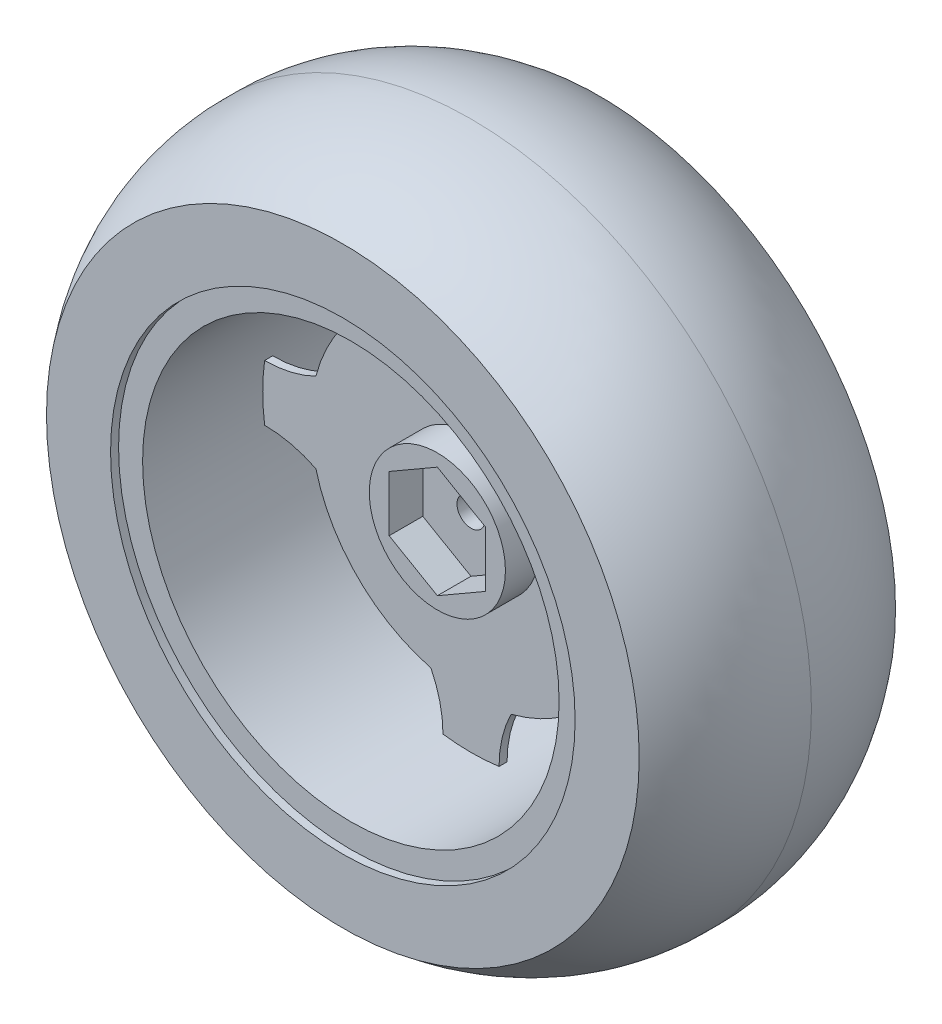
from build123d import *
from build123d.topology import SkipClean

# Parameters (mm, degrees)
SKETCH2_R            = 20
BOSS_EXTRUDE1_DEPTH  = 1
SKETCH3_R            = 8.5
BOSS_EXTRUDE2_DEPTH  = 4.2
BOSS_EXTRUDE4_DEPTH  = 2.5
BOSS_EXTRUDE5_DEPTH  = 3.5
CUT_EXTRUDE1_DEPTH   = 2.5
SKETCH14_R           = 1.75
CUT_EXTRUDE2_DEPTH   = 20.5
BOSS_EXTRUDE7_DEPTH  = 2.56
BOSS_EXTRUDE8_DEPTH  = 2.56
CUT_EXTRUDE4_DEPTH   = 1
CIRPATTERN3_COUNT    = 4
BOSS_EXTRUDE10_DEPTH = 2.56
SKETCH22_R           = 29
SKETCH22_R_2         = 26
BOSS_EXTRUDE11_DEPTH = 15
BOSS_EXTRUDE12_START = 15
SKETCH23_R           = 29
SKETCH23_R_2         = 26
BOSS_EXTRUDE12_DEPTH = 15
SKETCH25_R           = 37
SKETCH25_R_2         = 29
BOSS_EXTRUDE14_DEPTH = 16
BOSS_EXTRUDE15_START = 16
SKETCH26_R           = 37
SKETCH26_R_2         = 29
BOSS_EXTRUDE15_DEPTH = 16
SKETCH27_W           = 4.936524623
SKETCH27_H           = 8
BOSS_EXTRUDE16_DEPTH = 16
SKETCH29_W           = 16
SKETCH29_H           = 8
CUT_EXTRUDE5_DEPTH   = 16


with BuildPart() as part:
    # Sketch2 → Boss-Extrude1 (new body)
    with BuildSketch(Plane.XY):
        Circle(SKETCH2_R)
    extrude(amount=BOSS_EXTRUDE1_DEPTH)

    # Sketch3 → Boss-Extrude2 (add)
    with BuildSketch(Plane.XY.offset(1)):
        Circle(SKETCH3_R)
        Polygon((0, 6.95), (-6.018876556, 3.475), (-6.018876556, -3.475), (0, -6.95), (6.018876556, -3.475), (6.018876556, 3.475), align=None, mode=Mode.SUBTRACT)
    extrude(amount=BOSS_EXTRUDE2_DEPTH)

    # Sketch7 → Boss-Extrude4 (add)
    with BuildSketch(Plane(origin=(0, 0, 0), x_dir=(-1, 0, 0), z_dir=(0, 0, -1))):
        with BuildLine():
            Line((-12.53, 0), (0, 0))
            Line((0, 0), (12.53, 0))
            ThreePointArc((12.53, 0), (0, 12.53), (-12.53, 0))
        make_face()
    extrude(amount=BOSS_EXTRUDE4_DEPTH)

    # Sketch10 → Revolve1 (revolve)
    with BuildSketch(Plane.XZ):
        Polygon((12.53, -2.5), (20, 0), (12.53, 0), (0, 0), (0, -2.5), align=None)
    revolve(axis=Axis((0, 0, 0), (0, 0, -1)))

    # Sketch11 → Boss-Extrude5 (add)
    with BuildSketch(Plane(origin=(0, 0, -2.5), x_dir=(-1, 0, 0), z_dir=(0, 0, -1))):
        with BuildLine():
            ThreePointArc((25.763346056, -3.5), (22.477394983, -3.88001547), (19.364916731, -5))
            ThreePointArc((19.364916731, -5), (20, 0), (19.364916731, 5))
            ThreePointArc((19.364916731, 5), (22.477394983, 3.88001547), (25.763346056, 3.5))
            ThreePointArc((25.763346056, 3.5), (26, 0), (25.763346056, -3.5))
        make_face()
        with BuildLine():
            ThreePointArc((3.5, 25.763346056), (3.88001547, 22.477394983), (5, 19.364916731))
            ThreePointArc((5, 19.364916731), (0, 20), (-5, 19.364916731))
            ThreePointArc((-5, 19.364916731), (-3.88001547, 22.477394983), (-3.5, 25.763346056))
            ThreePointArc((-3.5, 25.763346056), (0, 26), (3.5, 25.763346056))
        make_face()
        with BuildLine():
            ThreePointArc((-3.5, -25.763346056), (-3.88001547, -22.477394983), (-5, -19.364916731))
            ThreePointArc((-5, -19.364916731), (0, -20), (5, -19.364916731))
            ThreePointArc((5, -19.364916731), (3.88001547, -22.477394983), (3.5, -25.763346056))
            ThreePointArc((3.5, -25.763346056), (0, -26), (-3.5, -25.763346056))
        make_face()
        with BuildLine():
            ThreePointArc((-25.763346056, 3.5), (-22.477394983, 3.88001547), (-19.364916731, 5))
            ThreePointArc((-19.364916731, 5), (-20, 0), (-19.364916731, -5))
            ThreePointArc((-19.364916731, -5), (-22.477394983, -3.88001547), (-25.763346056, -3.5))
            ThreePointArc((-25.763346056, -3.5), (-26, 0), (-25.763346056, 3.5))
        make_face()
    extrude(amount=-BOSS_EXTRUDE5_DEPTH)

    # Sketch13 → Cut-Extrude1 (cut)
    with BuildSketch(Plane(origin=(0, 0, -2.5), x_dir=(-1, 0, 0), z_dir=(0, 0, -1))):
        with BuildLine():
            ThreePointArc((-3.5, -25.763346056), (0, -26), (3.5, -25.763346056))
            ThreePointArc((3.5, -25.763346056), (3.88001547, -22.477394983), (5, -19.364916731))
            ThreePointArc((5, -19.364916731), (0, -20), (-5, -19.364916731))
            ThreePointArc((-5, -19.364916731), (-3.88001547, -22.477394983), (-3.5, -25.763346056))
        make_face()
        with BuildLine():
            ThreePointArc((5, 19.364916731), (0, 20), (-5, 19.364916731))
            ThreePointArc((-5, 19.364916731), (-3.88001547, 22.477394983), (-3.5, 25.763346056))
            ThreePointArc((-3.5, 25.763346056), (0, 26), (3.5, 25.763346056))
            ThreePointArc((3.5, 25.763346056), (3.88001547, 22.477394983), (5, 19.364916731))
        make_face()
        with BuildLine():
            ThreePointArc((25.763346056, -3.5), (22.477394983, -3.88001547), (19.364916731, -5))
            ThreePointArc((19.364916731, -5), (20, 0), (19.364916731, 5))
            ThreePointArc((19.364916731, 5), (22.477394983, 3.88001547), (25.763346056, 3.5))
            ThreePointArc((25.763346056, 3.5), (26, 0), (25.763346056, -3.5))
        make_face()
        with BuildLine():
            ThreePointArc((-25.763346056, -3.5), (-22.477394983, -3.88001547), (-19.364916731, -5))
            ThreePointArc((-19.364916731, -5), (-20, 0), (-19.364916731, 5))
            ThreePointArc((-19.364916731, 5), (-22.477394983, 3.88001547), (-25.763346056, 3.5))
            ThreePointArc((-25.763346056, 3.5), (-26, 0), (-25.763346056, -3.5))
        make_face()
    extrude(amount=-CUT_EXTRUDE1_DEPTH, mode=Mode.SUBTRACT)

    # Sketch14 → Cut-Extrude2 (cut)
    with BuildSketch(Plane(origin=(0, 0, -2.5), x_dir=(-1, 0, 0), z_dir=(0, 0, -1))):
        Circle(SKETCH14_R)
    extrude(amount=-CUT_EXTRUDE2_DEPTH, mode=Mode.SUBTRACT)

    # Sketch15 → Boss-Extrude7 (add)
    with BuildSketch(Plane(origin=(0, 0, -2.5), x_dir=(-1, 0, 0), z_dir=(0, 0, -1))):
        with BuildLine():
            ThreePointArc((-5.5, 0), (0, 5.5), (5.5, 0))
            Line((5.5, 0), (6, 0))
            ThreePointArc((6, 0), (0, 6), (-6, 0))
            Line((-6, 0), (-5.5, 0))
        make_face()
    extrude(amount=BOSS_EXTRUDE7_DEPTH)

    # Sketch18 → Boss-Extrude8 (add)
    with BuildSketch(Plane(origin=(0, 0, -2.5), x_dir=(-1, 0, 0), z_dir=(0, 0, -1))):
        with BuildLine():
            Line((12.528403729, 0.2), (5.99666574, 0.2))
            ThreePointArc((5.99666574, 0.2), (6, 0), (5.99666574, -0.2))
            Line((5.99666574, -0.2), (12.528403729, -0.2))
            ThreePointArc((12.528403729, -0.2), (12.53, 0), (12.528403729, 0.2))
        make_face()
    boss_extrude8 = extrude(amount=BOSS_EXTRUDE8_DEPTH)

    # Sketch19 → Cut-Extrude4 (cut)
    with BuildSketch(Plane.XZ.offset(0.2)):
        Polygon((-12.528403729, -5.06), (-13.38680772, -5.06), (-13.38680772, -2.5), (-12.528403729, -2.5), (-5.99666574, -4.849997635), (-5.99666574, -5.06), align=None)
    cut_extrude4 = extrude(amount=-CUT_EXTRUDE4_DEPTH, mode=Mode.SUBTRACT)

    # CirPattern3: Boss-Extrude8, Cut-Extrude4 ×4 about axis
    cirpattern3_axis = Axis((0, 0, 0), (0, 0, 1))
    add([boss_extrude8.rotate(cirpattern3_axis, i * 360 / CIRPATTERN3_COUNT) for i in range(1, CIRPATTERN3_COUNT)])
    add([cut_extrude4.rotate(cirpattern3_axis, i * 360 / CIRPATTERN3_COUNT) for i in range(1, CIRPATTERN3_COUNT)], mode=Mode.SUBTRACT)

    # Sketch20 → Boss-Extrude10 (add)
    with SkipClean():  # the faces are left unmerged after this step: merging them gives an invalid solid
        with BuildSketch(Plane(origin=(0, 0, -2.5), x_dir=(-1, 0, 0), z_dir=(0, 0, -1))):
            with BuildLine():
                Line((-6, 0), (-5.5, 0))
                ThreePointArc((-5.5, 0), (0, -5.5), (5.5, 0))
                Line((5.5, 0), (6, 0))
                ThreePointArc((6, 0), (0, -6), (-6, 0))
            make_face()
        extrude(amount=BOSS_EXTRUDE10_DEPTH)



with BuildPart() as body_2:
    # Sketch22 → Boss-Extrude11 (new body)
    with BuildSketch(Plane.XY.offset(1)):
        Circle(SKETCH22_R)
        Circle(SKETCH22_R_2, mode=Mode.SUBTRACT)
    extrude(amount=BOSS_EXTRUDE11_DEPTH)


with BuildPart() as part_1:
    with SkipClean():  # the faces are left unmerged after this step: merging them gives an invalid solid
        add(part.part)

        add(body_2.part)  # Boss-Extrude12 merges body 2
        # Sketch23 → Boss-Extrude12 (add)
        with BuildSketch(Plane(origin=(0, 0, 1), x_dir=(-1, 0, 0), z_dir=(0, 0, -1)).offset(BOSS_EXTRUDE12_START)):
            with Locations(Location((0, 0, 0), (0, 0, 180))):
                Circle(SKETCH23_R)
            with Locations(Location((0, 0, 0), (0, 0, 180))):
                Circle(SKETCH23_R_2, mode=Mode.SUBTRACT)
        extrude(amount=-BOSS_EXTRUDE12_DEPTH)

    # Sketch25 → Boss-Extrude14 (add)
    with SkipClean():  # the faces are left unmerged after this step: merging them gives an invalid solid
        with BuildSketch(Plane.XY.offset(1)):
            Circle(SKETCH25_R)
            Circle(SKETCH25_R_2, mode=Mode.SUBTRACT)
        extrude(amount=BOSS_EXTRUDE14_DEPTH)

    # Sketch26 → Boss-Extrude15 (add)
    with SkipClean():  # the faces are left unmerged after this step: merging them gives an invalid solid
        with BuildSketch(Plane(origin=(0, 0, 1), x_dir=(-1, 0, 0), z_dir=(0, 0, -1)).offset(BOSS_EXTRUDE15_START)):
            Circle(SKETCH26_R)
            with Locations(Location((0, 0, 0), (0, 0, 180))):
                Circle(SKETCH26_R_2, mode=Mode.SUBTRACT)
        extrude(amount=-BOSS_EXTRUDE15_DEPTH)

    # Sketch27 → Boss-Extrude16 (add)
    with SkipClean():  # the faces are left unmerged after this step: merging them gives an invalid solid
        with BuildSketch(Plane.XY.offset(17)):
            with Locations((2.468262312, 33)):
                Rectangle(SKETCH27_W, SKETCH27_H)
        extrude(amount=BOSS_EXTRUDE16_DEPTH)

    # Sketch28 → Revolve2 (revolve)
    with SkipClean():  # the faces are left unmerged after this step: merging them gives an invalid solid
        with BuildSketch(Plane.ZY):
            with BuildLine():
                ThreePointArc((1, 42.5), (9.485130196, 41.161287844), (17, 37))
                Line((17, 37), (-15, 37))
                ThreePointArc((-15, 37), (-7.485130196, 41.161287844), (1, 42.5))
            make_face()
        revolve(axis=Axis((0, 0, -15), (0, 0, 1)))

    # Sketch29 → Cut-Extrude5 (cut)
    with SkipClean():  # the faces are left unmerged after this step: merging them gives an invalid solid
        with BuildSketch(Plane(origin=(4.936524623, 0, 0), x_dir=(0, 0, -1), z_dir=(1, 0, 0))):
            with Locations((-25, 33)):
                Rectangle(SKETCH29_W, SKETCH29_H)
        extrude(amount=-CUT_EXTRUDE5_DEPTH, mode=Mode.SUBTRACT)


solid = part_1.part
